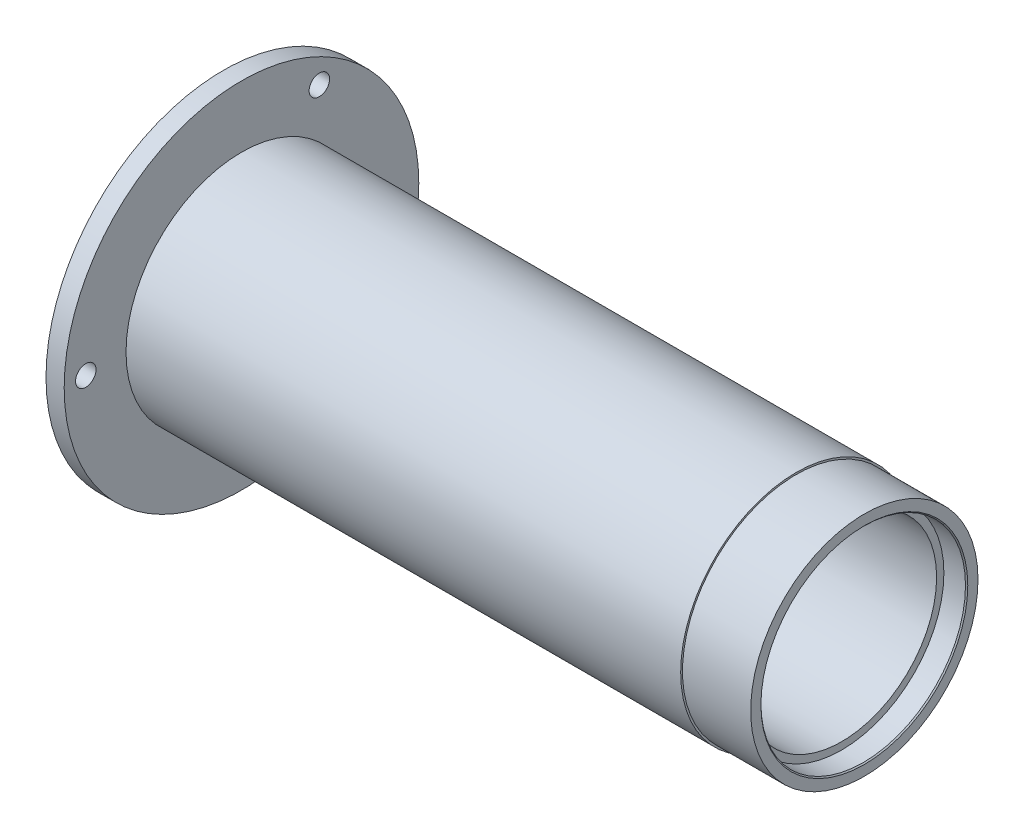
from build123d import *

# Parameters (mm, degrees)
SKETCH_1_R               = 78
EXTRUDE_1_DEPTH          = 8
SKETCH_2_R               = 50.8
EXTRUDE_2_DEPTH          = 252
SKETCH_3_R               = 50
EXTRUDE_3_DEPTH          = 282
CUT_EXTRUDE_1_DEPTH      = 303.806869143
CUT_EXTRUDE_1_DEPTH_BACK = 303.806869143
SKETCH_4_R               = 41.8
SKETCH_6_R               = 45
CUT_EXTRUDE_3_DEPTH      = 10
CUT_EXTRUDE_START        = -10
SKETCH_7_R               = 45
CUT_EXTRUDE_4_DEPTH      = 10
CUT_EXTRUDE_5_DEPTH      = 303.806869143
CUT_EXTRUDE_5_DEPTH_BACK = 303.806869143
SKETCH_8_R               = 4.5
CHAMFER_1_SIZE           = 0.5
CHAMFER_2_SIZE           = 0.5


with BuildPart() as part:
    # ｽｹｯﾁ1 → ﾎﾞｽ - 押し出し1 (new body)
    with BuildSketch(Plane(origin=(0, 0, 0), x_dir=(0, 0, -1), z_dir=(1, 0, 0))):
        Circle(SKETCH_1_R)
    extrude(amount=EXTRUDE_1_DEPTH)

    # ｽｹｯﾁ2 → ﾎﾞｽ - 押し出し2 (add)
    with BuildSketch(Plane(origin=(0, 0, 0), x_dir=(0, 0, -1), z_dir=(1, 0, 0))):
        Circle(SKETCH_2_R)
    extrude(amount=EXTRUDE_2_DEPTH)

    # ｽｹｯﾁ3 → ﾎﾞｽ - 押し出し3 (add)
    with BuildSketch(Plane(origin=(0, 0, 0), x_dir=(0, 0, -1), z_dir=(1, 0, 0))):
        Circle(SKETCH_3_R)
    extrude(amount=EXTRUDE_3_DEPTH)

    # ｽｹｯﾁ4 → ｶｯﾄ - 押し出し1 (cut, two sides: drawn at the far end of the back side and taken through both)
    with BuildSketch(Plane(origin=(0, 0, 0), x_dir=(0, 0, -1), z_dir=(1, 0, 0)).offset(-CUT_EXTRUDE_1_DEPTH_BACK)):
        Circle(SKETCH_4_R)
    extrude(amount=CUT_EXTRUDE_1_DEPTH + CUT_EXTRUDE_1_DEPTH_BACK, mode=Mode.SUBTRACT)

    # ｽｹｯﾁ6 → ｶｯﾄ - 押し出し3 (cut)
    with BuildSketch(Plane(origin=(0, 0, 0), x_dir=(0, 0, -1), z_dir=(1, 0, 0))):
        Circle(SKETCH_6_R)
    extrude(amount=CUT_EXTRUDE_3_DEPTH, mode=Mode.SUBTRACT)

    # ｽｹｯﾁ7 → ｶｯﾄ - 押し出し4 (cut)
    with BuildSketch(Plane(origin=(282, 0, 0), x_dir=(0, 0, -1), z_dir=(1, 0, 0)).offset(CUT_EXTRUDE_START)):
        Circle(SKETCH_7_R)
    extrude(amount=CUT_EXTRUDE_4_DEPTH, mode=Mode.SUBTRACT)

    # ｽｹｯﾁ8 → ｶｯﾄ - 押し出し5 (cut, two sides: drawn at the far end of the back side and taken through both)
    with BuildSketch(Plane(origin=(0, 0, 0), x_dir=(0, 0, -1), z_dir=(1, 0, 0)).offset(-CUT_EXTRUDE_5_DEPTH_BACK)):
        with Locations((-68.5, 0)):
            Circle(SKETCH_8_R)
        with Locations((34.25, 59.322740159)):
            Circle(SKETCH_8_R)
        with Locations((34.25, -59.322740159)):
            Circle(SKETCH_8_R)
    extrude(amount=CUT_EXTRUDE_5_DEPTH + CUT_EXTRUDE_5_DEPTH_BACK, mode=Mode.SUBTRACT)

    # 面取り1
    chamfer_1_edges = [part.edges().sort_by_distance(p)[0] for p in [
        (0, 0, 45),
    ]]
    chamfer(chamfer_1_edges, length=CHAMFER_1_SIZE)

    # 面取り2
    chamfer_2_edges = [part.edges().sort_by_distance(p)[0] for p in [
        (282, 0, 45),
    ]]
    chamfer(chamfer_2_edges, length=CHAMFER_2_SIZE)


solid = part.part
